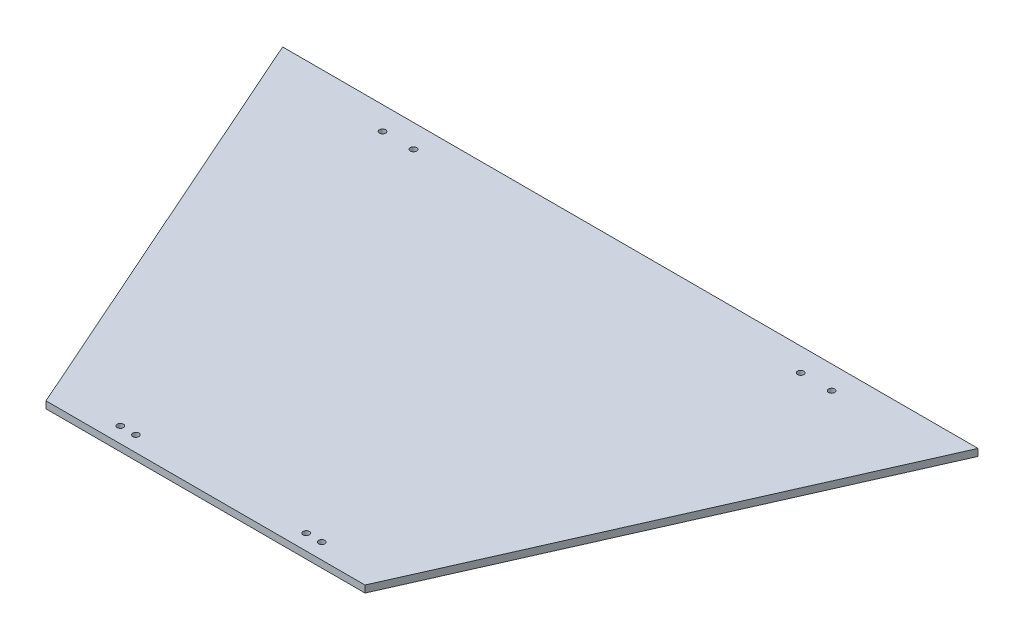
from build123d import *

# Parameters (mm, degrees)
EXTRUDE_1_DEPTH     = 4.5
SKETCH_3_R          = 2
CUT_EXTRUDE_1_DEPTH = 10


with BuildPart() as part:
    # 草图1 → 凸台-拉伸1 (new body)
    with BuildSketch(Plane(origin=(0, 0, 0), x_dir=(1, 0, 0), z_dir=(0, 1, 0))):
        Polygon((-224.5, 274.3), (224.5, 274.3), (103, 0), (-103, 0), align=None)
    extrude(amount=EXTRUDE_1_DEPTH)

    # 草图3 → 切除-拉伸1 (cut)
    with BuildSketch(Plane(origin=(0, 4.5, 0), x_dir=(1, 0, 0), z_dir=(0, 1, 0))):
        with Locations(Location((-145, 259.3, 0), (0, 0, 270))):
            Circle(SKETCH_3_R)
        with Locations(Location((-125, 259.3, 0), (0, 0, 270))):
            Circle(SKETCH_3_R)
        with Locations(Location((125, 259.3, 0), (0, 0, 90))):
            Circle(SKETCH_3_R)
        with Locations(Location((145, 259.3, 0), (0, 0, 90))):
            Circle(SKETCH_3_R)
        with Locations(Location((-65, 10, 0), (0, 0, 270))):
            Circle(SKETCH_3_R)
        with Locations(Location((-55, 10, 0), (0, 0, 270))):
            Circle(SKETCH_3_R)
        with Locations(Location((55, 10, 0), (0, 0, 90))):
            Circle(SKETCH_3_R)
        with Locations(Location((65, 10, 0), (0, 0, 90))):
            Circle(SKETCH_3_R)
    extrude(amount=-CUT_EXTRUDE_1_DEPTH, mode=Mode.SUBTRACT)


solid = part.part
